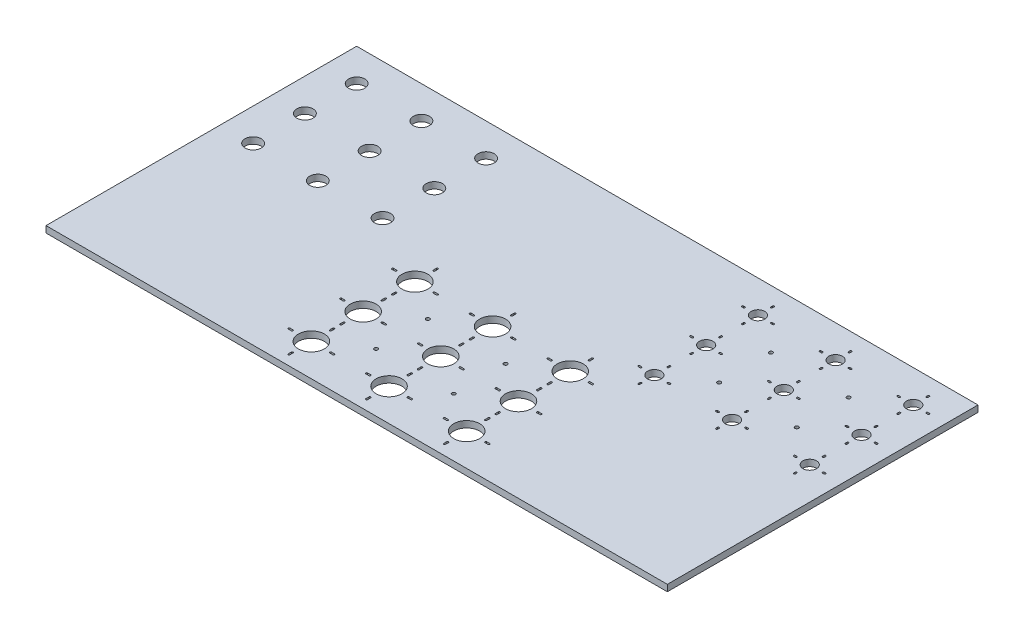
from build123d import *

# Parameters (mm, degrees)
SKETCH1_W            = 609.6
SKETCH1_H            = 304.8
BOSS_EXTRUDE1_DEPTH  = 6.35
SKETCH2_R            = 7.9375
CUT_EXTRUDE1_DEPTH   = 6.35
SKETCH3_R            = 6.6675
CUT_EXTRUDE2_DEPTH   = 6.35
SKETCH4_R            = 12.7
CUT_EXTRUDE3_DEPTH   = 682.583100216
CUT_EXTRUDE5_DEPTH   = 682.583100216
LPATTERN1_COUNT      = 3
LPATTERN1_PITCH      = 76.2
LPATTERN1_COUNT_DIR2 = 3
LPATTERN1_PITCH_DIR2 = 50.8
CUT_EXTRUDE6_DEPTH   = 682.583100216
LPATTERN2_COUNT      = 3
LPATTERN2_PITCH      = 76.2
LPATTERN2_COUNT_DIR2 = 3
LPATTERN2_PITCH_DIR2 = 50.8
SKETCH8_R            = 1.778
CUT_EXTRUDE7_DEPTH   = 2.54
SKETCH9_R            = 1.778
CUT_EXTRUDE8_DEPTH   = 682.583100216


with BuildPart() as part:
    # Sketch1 → Boss-Extrude1 (new body)
    with BuildSketch(Plane(origin=(0, 0, 0), x_dir=(1, 0, 0), z_dir=(0, 1, 0))):
        with Locations((304.8, -152.4)):
            Rectangle(SKETCH1_W, SKETCH1_H)
    extrude(amount=BOSS_EXTRUDE1_DEPTH)

    # Sketch2 → Cut-Extrude1 (cut)
    with BuildSketch(Plane(origin=(0, 6.35, 0), x_dir=(1, 0, 0), z_dir=(0, 1, 0))):
        with Locations(Location((31.75, -31.75, 0), (0, 0, 270))):
            Circle(SKETCH2_R)
        with Locations(Location((95.25, -31.75, 0), (0, 0, 270))):
            Circle(SKETCH2_R)
        with Locations(Location((158.75, -31.75, 0), (0, 0, 270))):
            Circle(SKETCH2_R)
        with Locations(Location((95.25, -82.55, 0), (0, 0, 270))):
            Circle(SKETCH2_R)
        with Locations(Location((158.75, -82.55, 0), (0, 0, 270))):
            Circle(SKETCH2_R)
        with Locations(Location((95.25, -133.35, 0), (0, 0, 270))):
            Circle(SKETCH2_R)
        with Locations(Location((158.75, -133.35, 0), (0, 0, 270))):
            Circle(SKETCH2_R)
        with Locations(Location((31.75, -82.55, 0), (0, 0, 270))):
            Circle(SKETCH2_R)
        with Locations(Location((31.75, -133.35, 0), (0, 0, 270))):
            Circle(SKETCH2_R)
    extrude(amount=-CUT_EXTRUDE1_DEPTH, mode=Mode.SUBTRACT)

    # Sketch3 → Cut-Extrude2 (cut)
    with BuildSketch(Plane(origin=(0, 6.35, 0), x_dir=(1, 0, 0), z_dir=(0, 1, 0))):
        with Locations(Location((577.85, -31.75, 0), (0, 0, 270))):
            Circle(SKETCH3_R)
        with Locations(Location((501.65, -31.75, 0), (0, 0, 270))):
            Circle(SKETCH3_R)
        with Locations(Location((425.45, -31.75, 0), (0, 0, 270))):
            Circle(SKETCH3_R)
        with Locations(Location((501.65, -82.55, 0), (0, 0, 270))):
            Circle(SKETCH3_R)
        with Locations(Location((425.45, -82.55, 0), (0, 0, 270))):
            Circle(SKETCH3_R)
        with Locations(Location((501.65, -133.35, 0), (0, 0, 270))):
            Circle(SKETCH3_R)
        with Locations(Location((425.45, -133.35, 0), (0, 0, 270))):
            Circle(SKETCH3_R)
        with Locations(Location((577.85, -82.55, 0), (0, 0, 270))):
            Circle(SKETCH3_R)
        with Locations(Location((577.85, -133.35, 0), (0, 0, 270))):
            Circle(SKETCH3_R)
    extrude(amount=-CUT_EXTRUDE2_DEPTH, mode=Mode.SUBTRACT)

    # Sketch4 → Cut-Extrude3 (cut, through all)
    with BuildSketch(Plane(origin=(0, 6.35, 0), x_dir=(1, 0, 0), z_dir=(0, 1, 0))):
        with Locations(Location((304.8, -273.05, 0), (0, 0, 270))):
            Circle(SKETCH4_R)
        with Locations(Location((228.6, -273.05, 0), (0, 0, 270))):
            Circle(SKETCH4_R)
        with Locations(Location((381, -273.05, 0), (0, 0, 270))):
            Circle(SKETCH4_R)
        with Locations(Location((228.6, -222.25, 0), (0, 0, 270))):
            Circle(SKETCH4_R)
        with Locations(Location((304.8, -222.25, 0), (0, 0, 270))):
            Circle(SKETCH4_R)
        with Locations(Location((381, -222.25, 0), (0, 0, 270))):
            Circle(SKETCH4_R)
        with Locations(Location((228.6, -171.45, 0), (0, 0, 270))):
            Circle(SKETCH4_R)
        with Locations(Location((304.8, -171.45, 0), (0, 0, 270))):
            Circle(SKETCH4_R)
        with Locations(Location((381, -171.45, 0), (0, 0, 270))):
            Circle(SKETCH4_R)
    extrude(amount=-CUT_EXTRUDE3_DEPTH, mode=Mode.SUBTRACT)

    # Sketch6 → Cut-Extrude5 (cut, through all)
    with BuildSketch(Plane(origin=(0, 6.35, 0), x_dir=(1, 0, 0), z_dir=(0, 1, 0))):
        with BuildLine():
            Line((229.4509, -149.606), (229.4509, -152.654))
            ThreePointArc((229.4509, -152.654), (228.6, -153.5049), (227.7491, -152.654))
            Line((227.7491, -152.654), (227.7491, -149.606))
            ThreePointArc((227.7491, -149.606), (228.6, -148.7551), (229.4509, -149.606))
        make_face()
        with BuildLine():
            Line((250.444, -170.5991), (247.396, -170.5991))
            ThreePointArc((247.396, -170.5991), (246.5451, -171.45), (247.396, -172.3009))
            Line((247.396, -172.3009), (250.444, -172.3009))
            ThreePointArc((250.444, -172.3009), (251.2949, -171.45), (250.444, -170.5991))
        make_face()
        with BuildLine():
            Line((229.4509, -193.294), (229.4509, -190.246))
            ThreePointArc((229.4509, -190.246), (228.6, -189.3951), (227.7491, -190.246))
            Line((227.7491, -190.246), (227.7491, -193.294))
            ThreePointArc((227.7491, -193.294), (228.6, -194.1449), (229.4509, -193.294))
        make_face()
        with BuildLine():
            Line((206.756, -172.3009), (209.804, -172.3009))
            ThreePointArc((209.804, -172.3009), (210.6549, -171.45), (209.804, -170.5991))
            Line((209.804, -170.5991), (206.756, -170.5991))
            ThreePointArc((206.756, -170.5991), (205.9051, -171.45), (206.756, -172.3009))
        make_face()
    cut_extrude5 = extrude(amount=-CUT_EXTRUDE5_DEPTH, mode=Mode.SUBTRACT)

    # LPattern1: Cut-Extrude5 3 × 3
    with Locations(*[(i * LPATTERN1_PITCH, 0, j * LPATTERN1_PITCH_DIR2) for i in range(LPATTERN1_COUNT) for j in range(LPATTERN1_COUNT_DIR2) if (i, j) != (0, 0)]):
        add(cut_extrude5, mode=Mode.SUBTRACT)

    # Sketch7 → Cut-Extrude6 (cut, through all)
    with BuildSketch(Plane(origin=(0, 6.35, 0), x_dir=(1, 0, 0), z_dir=(0, 1, 0))):
        with BuildLine():
            Line((424.5991, -18.288), (424.5991, -16.764))
            ThreePointArc((424.5991, -16.764), (425.45, -15.9131), (426.3009, -16.764))
            Line((426.3009, -16.764), (426.3009, -18.288))
            ThreePointArc((426.3009, -18.288), (425.45, -19.1389), (424.5991, -18.288))
        make_face()
        with BuildLine():
            Line((438.912, -32.6009), (440.436, -32.6009))
            ThreePointArc((440.436, -32.6009), (441.2869, -31.75), (440.436, -30.8991))
            Line((440.436, -30.8991), (438.912, -30.8991))
            ThreePointArc((438.912, -30.8991), (438.0611, -31.75), (438.912, -32.6009))
        make_face()
        with BuildLine():
            Line((424.5991, -45.212), (424.5991, -46.736))
            ThreePointArc((424.5991, -46.736), (425.45, -47.5869), (426.3009, -46.736))
            Line((426.3009, -46.736), (426.3009, -45.212))
            ThreePointArc((426.3009, -45.212), (425.45, -44.3611), (424.5991, -45.212))
        make_face()
        with BuildLine():
            Line((411.988, -30.8991), (410.464, -30.8991))
            ThreePointArc((410.464, -30.8991), (409.6131, -31.75), (410.464, -32.6009))
            Line((410.464, -32.6009), (411.988, -32.6009))
            ThreePointArc((411.988, -32.6009), (412.8389, -31.75), (411.988, -30.8991))
        make_face()
    cut_extrude6 = extrude(amount=-CUT_EXTRUDE6_DEPTH, mode=Mode.SUBTRACT)

    # LPattern2: Cut-Extrude6 3 × 3
    with Locations(*[(i * LPATTERN2_PITCH, 0, j * LPATTERN2_PITCH_DIR2) for i in range(LPATTERN2_COUNT) for j in range(LPATTERN2_COUNT_DIR2) if (i, j) != (0, 0)]):
        add(cut_extrude6, mode=Mode.SUBTRACT)

    # Sketch8 → Cut-Extrude7 (cut)
    with BuildSketch(Plane(origin=(0, 6.35, 0), x_dir=(1, 0, 0), z_dir=(0, 1, 0))):
        with Locations(Location((266.7, -196.85, 0), (0, 0, 270))):
            Circle(SKETCH8_R)
        with Locations(Location((342.9, -196.85, 0), (0, 0, 90))):
            Circle(SKETCH8_R)
        with Locations(Location((342.9, -247.65, 0), (0, 0, 270))):
            Circle(SKETCH8_R)
        with Locations(Location((266.7, -247.65, 0), (0, 0, 90))):
            Circle(SKETCH8_R)
    extrude(amount=-CUT_EXTRUDE7_DEPTH, mode=Mode.SUBTRACT)

    # Sketch9 → Cut-Extrude8 (cut, through all)
    with BuildSketch(Plane(origin=(0, 6.35, 0), x_dir=(1, 0, 0), z_dir=(0, 1, 0))):
        with Locations(Location((463.55, -57.15, 0), (0, 0, 270))):
            Circle(SKETCH9_R)
        with Locations(Location((539.75, -57.15, 0), (0, 0, 90))):
            Circle(SKETCH9_R)
        with Locations(Location((539.75, -107.95, 0), (0, 0, 270))):
            Circle(SKETCH9_R)
        with Locations(Location((463.55, -107.95, 0), (0, 0, 90))):
            Circle(SKETCH9_R)
    extrude(amount=-CUT_EXTRUDE8_DEPTH, mode=Mode.SUBTRACT)


solid = part.part
